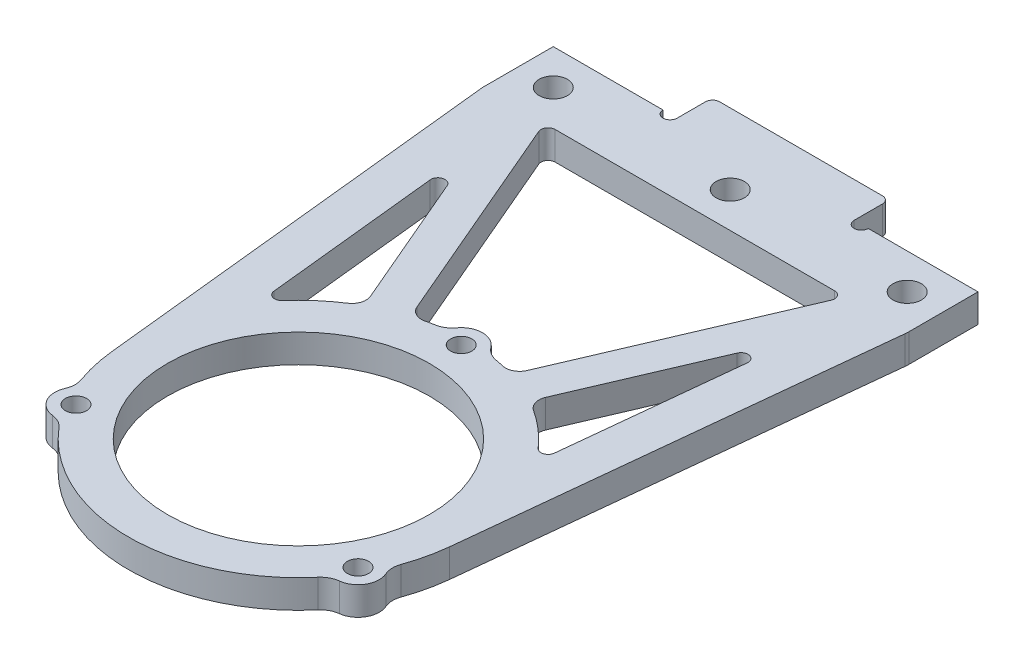
from build123d import *

# Parameters (mm, degrees)
SKETCH_1_R          = 18.5
EXTRUDE_1_DEPTH     = 4
SKETCH_2_R          = 5
SKETCH_2_R_2        = 1.5
CUT_EXTRUDE_1_DEPTH = 10
SKETCH_4_R          = 2
CUT_EXTRUDE_2_DEPTH = 4
SKETCH_5_W          = 25
SKETCH_5_H          = 5
EXTRUDE_2_DEPTH     = 4
SKETCH_6_R          = 1
CUT_EXTRUDE_3_DEPTH = 10
FILLET_2_R          = 1
CUT_EXTRUDE_START   = -5
CUT_EXTRUDE_4_DEPTH = 5
EXTRUDE_1_2_DEPTH   = 4
FILLET_3_R          = 2
FILLET_4_R          = 3
FILLET_5_R          = 1
SKETCH_10_R         = 3
SKETCH_10_R_2       = 1.5
EXTRUDE_3_DEPTH     = 4
FILLET_6_R          = 3
CUT_EXTRUDE_5_DEPTH = 4
FILLET_7_R          = 5


with BuildPart() as part:
    # 草图1 → Extrude 1 (new body)
    with BuildSketch(Plane(origin=(0, 0, 0), x_dir=(1, 0, 0), z_dir=(0, 1, 0))):
        with BuildLine():
            ThreePointArc((-23.869289328, -2.501404997), (0, -24), (23.869289328, -2.501404997))
            Line((23.869289328, -2.501404997), (31.047959561, 66))
            Line((31.047959561, 66), (-31.047959561, 66))
            Line((-31.047959561, 66), (-23.869289328, -2.501404997))
        make_face()
        with Locations(Location((0, 0, 0), (0, 0, 270))):
            Circle(SKETCH_1_R, mode=Mode.SUBTRACT)
    extrude(amount=EXTRUDE_1_DEPTH)

    # 草图2 → 切除-拉伸1 (cut)
    with BuildSketch(Plane(origin=(0, 4, 0), x_dir=(1, 0, 0), z_dir=(0, 1, 0))):
        with Locations((0, -31.5)):
            Circle(SKETCH_2_R)
        with Locations(Location((0, 23, 0), (0, 0, 270))):
            Circle(SKETCH_2_R_2)
        with Locations((19.918584287, -11.5)):
            Circle(SKETCH_2_R_2)
        with Locations((-19.918584287, -11.5)):
            Circle(SKETCH_2_R_2)
    extrude(amount=-CUT_EXTRUDE_1_DEPTH, mode=Mode.SUBTRACT)

    # 草图4 → 切除-拉伸2 (cut)
    with BuildSketch(Plane(origin=(0, 4, 0), x_dir=(1, 0, 0), z_dir=(0, 1, 0))):
        with Locations(Location((-25, 61, 0), (0, 0, 270))):
            Circle(SKETCH_4_R)
        with Locations(Location((0, 61, 0), (0, 0, 270))):
            Circle(SKETCH_4_R)
        with Locations(Location((25, 61, 0), (0, 0, 270))):
            Circle(SKETCH_4_R)
    extrude(amount=-CUT_EXTRUDE_2_DEPTH, mode=Mode.SUBTRACT)

    # 草图5 → 凸台-拉伸2 (add)
    with BuildSketch(Plane(origin=(0, 4, 0), x_dir=(1, 0, 0), z_dir=(0, 1, 0))):
        with Locations((0, 68.5)):
            Rectangle(SKETCH_5_W, SKETCH_5_H)
    extrude(amount=-EXTRUDE_2_DEPTH)

    # 草图6 → 切除-拉伸3 (cut)
    with BuildSketch(Plane(origin=(0, 4, 0), x_dir=(1, 0, 0), z_dir=(0, 1, 0))):
        with Locations((-13.5, 66)):
            Circle(SKETCH_6_R)
        with Locations((13.5, 66)):
            Circle(SKETCH_6_R)
    extrude(amount=-CUT_EXTRUDE_3_DEPTH, mode=Mode.SUBTRACT)

    # 圆角2
    fillet_2_edges = [part.edges().sort_by_distance(p)[0] for p in [
        (12.5, 2, -71),
        (-12.5, 2, -71),
    ]]
    fillet(fillet_2_edges, radius=FILLET_2_R)

    # 草图7 → 切除-拉伸4 (cut)
    with BuildSketch(Plane(origin=(0, 4, 0), x_dir=(1, 0, 0), z_dir=(0, 1, 0)).offset(CUT_EXTRUDE_START)):
        with BuildLine():
            Line((-19.556490884, 13.911997136), (-23.967143386, 56))
            Line((-23.967143386, 56), (23.967143386, 56))
            Line((23.967143386, 56), (19.556490884, 13.911997136))
            ThreePointArc((19.556490884, 13.911997136), (12.266476425, 20.628464705), (2.884021557, 23.826086957))
            ThreePointArc((2.884021557, 23.826086957), (0, 26), (-2.884021557, 23.826086957))
            ThreePointArc((-2.884021557, 23.826086957), (-12.266476425, 20.628464705), (-19.556490884, 13.911997136))
        make_face()
    extrude(amount=CUT_EXTRUDE_4_DEPTH, mode=Mode.SUBTRACT)

    # 草图8 → Extrude 1 2 (add)
    with BuildSketch(Plane(origin=(0, 4, 0), x_dir=(1, 0, 0), z_dir=(0, 1, 0))):
        Polygon((-26.265493929, 55.016341125), (-9.577426219, 16.024135141), (-4.980725133, 17.991452891), (-21.668792843, 56.983658875), align=None)
        Polygon((21.668792843, 56.983658875), (4.980725133, 17.991452891), (9.577426219, 16.024135141), (26.265493929, 55.016341125), align=None)
    extrude(amount=-EXTRUDE_1_2_DEPTH)

    # 圆角3
    fillet_3_edges = [part.edges().sort_by_distance(p)[0] for p in [
        (-11.690103776, 2, -20.960474081),
        (-7.09340269, 2, -22.927791832),
        (11.690103776, 2, -20.960474081),
        (7.09340269, 2, -22.927791832),
    ]]
    fillet(fillet_3_edges, radius=FILLET_3_R)

    # 圆角4
    fillet_4_edges = [part.edges().sort_by_distance(p)[0] for p in [
        (-2.884021557, 2, -23.826086957),
        (2.884021557, 2, -23.826086957),
    ]]
    fillet(fillet_4_edges, radius=FILLET_4_R)

    # 圆角5
    fillet_5_edges = [part.edges().sort_by_distance(p)[0] for p in [
        (-19.556490884, 2, -13.911997136),
        (19.556490884, 2, -13.911997136),
        (-21.247801891, 2, -56),
        (-23.085380037, 2, -47.585902918),
        (21.247801891, 2, -56),
        (23.085380037, 2, -47.585902918),
    ]]
    fillet(fillet_5_edges, radius=FILLET_5_R)

    # 草图10 → 凸台-拉伸3 (add)
    # profile 1 of 2: a face of its own
    with BuildSketch(Plane(origin=(0, 4, 0), x_dir=(1, 0, 0), z_dir=(0, 1, 0))):
        with Locations((-19.918584287, -11.5)):
            Circle(SKETCH_10_R)
        with Locations(Location((-19.918584287, -11.5, 0), (0, 0, 270))):
            Circle(SKETCH_10_R_2, mode=Mode.SUBTRACT)
    # profile 2 of 2: a face of its own
    with BuildSketch(Plane(origin=(0, 4, 0), x_dir=(1, 0, 0), z_dir=(0, 1, 0))):
        with Locations((19.918584287, -11.5)):
            Circle(SKETCH_10_R)
        with Locations(Location((19.918584287, -11.5, 0), (0, 0, 270))):
            Circle(SKETCH_10_R_2, mode=Mode.SUBTRACT)
    extrude(amount=-EXTRUDE_3_DEPTH)

    # 圆角6
    fillet_6_edges = [part.edges().sort_by_distance(p)[0] for p in [
        (-22.076007356, 2, 9.415407545),
        (-19.191985799, 2, 14.410679412),
        (22.076007356, 2, 9.415407545),
        (19.191985799, 2, 14.410679412),
    ]]
    fillet(fillet_6_edges, radius=FILLET_6_R)

    # 草图11 → 切除-拉伸5 (cut)
    with BuildSketch(Plane(origin=(0, 4, 0), x_dir=(1, 0, 0), z_dir=(0, 1, 0))):
        Polygon((-30, 66), (-30, 56), (-31.047959561, 66), align=None)
        Polygon((30, 66), (31.047959561, 66), (30, 56), align=None)
    extrude(amount=-CUT_EXTRUDE_5_DEPTH, mode=Mode.SUBTRACT)

    # 圆角7
    fillet_7_edges = [part.edges().sort_by_distance(p)[0] for p in [
        (-30, 2, -56),
        (30, 2, -56),
    ]]
    fillet(fillet_7_edges, radius=FILLET_7_R)


solid = part.part
